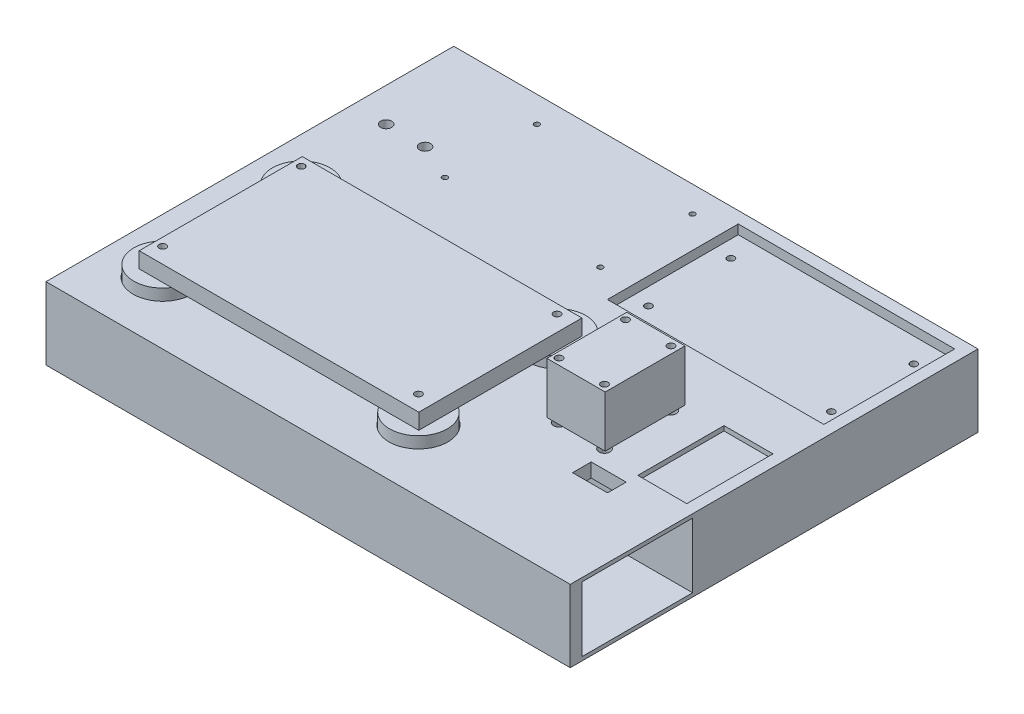
from build123d import *

# Parameters (mm, degrees)
SKETCH1_W                = 120
SKETCH1_H                = 70
SKETCH1_R                = 1.5
BOSS_EXTRUDE1_DEPTH      = 6.75
SKETCH3_R                = 12.375
BOSS_EXTRUDE2_DEPTH      = 9.75
BOSS_EXTRUDE3_DEPTH      = 26
BOSS_EXTRUDE3_DEPTH_BACK = 5
SKETCH5_W                = 225
SKETCH5_H                = 175
SKETCH8_R                = 12.625
CUT_EXTRUDE3_DEPTH       = 4
BOSS_EXTRUDE4_START      = 2
SKETCH9_W                = 25
SKETCH9_H                = 34.25
SKETCH9_R                = 1.525
BOSS_EXTRUDE4_DEPTH      = 22
SKETCH10_R               = 2.375
CUT_EXTRUDE11_DEPTH      = 10
SKETCH12_W               = 21
SKETCH12_H               = 37
CUT_EXTRUDE4_DEPTH       = 2
SKETCH11_W               = 92.9
SKETCH11_H               = 56.15
CUT_EXTRUDE8_DEPTH       = 4
SKETCH18_R               = 1.5
CUT_EXTRUDE12_DEPTH      = 10
SKETCH19_R               = 1.125
CUT_EXTRUDE13_DEPTH      = 10
SKETCH20_R               = 2.375
CUT_EXTRUDE15_DEPTH      = 10
SKETCH22_W               = 47.5
SKETCH22_H               = 27.775
CUT_EXTRUDE16_DEPTH      = 20
SKETCH23_W               = 15
SKETCH23_H               = 8
CUT_EXTRUDE17_DEPTH      = 29.3875
SKETCH24_W               = 47.5
SKETCH24_H               = 23.3875
CUT_EXTRUDE18_DEPTH      = 30


with BuildPart() as part:
    # Sketch1 → Boss-Extrude1 (new body)
    with BuildSketch(Plane(origin=(0, 0, 0), x_dir=(1, 0, 0), z_dir=(0, 1, 0))):
        Rectangle(SKETCH1_W, SKETCH1_H)
        with Locations(Location((-56.6, 31.15, 0), (0, 0, 270))):
            Circle(SKETCH1_R, mode=Mode.SUBTRACT)
        with Locations(Location((53.2, 31.15, 0), (0, 0, 90))):
            Circle(SKETCH1_R, mode=Mode.SUBTRACT)
        with Locations(Location((53.2, -28.35, 0), (0, 0, 270))):
            Circle(SKETCH1_R, mode=Mode.SUBTRACT)
        with Locations(Location((-56.6, -28.35, 0), (0, 0, 90))):
            Circle(SKETCH1_R, mode=Mode.SUBTRACT)
    extrude(amount=BOSS_EXTRUDE1_DEPTH)

    # Sketch3 → Boss-Extrude2 (add)
    with BuildSketch(Plane.XZ):
        with Locations(Location((-56.6, 28.35, 0), (0, 0, 90))):
            Circle(SKETCH3_R)
        with Locations(Location((53.2, 28.35, 0), (0, 0, 90))):
            Circle(SKETCH3_R)
        with Locations(Location((53.2, -31.15, 0), (0, 0, 90))):
            Circle(SKETCH3_R)
        with Locations(Location((-56.6, -31.15, 0), (0, 0, 90))):
            Circle(SKETCH3_R)
    extrude(amount=BOSS_EXTRUDE2_DEPTH)


with BuildPart() as body_2:
    # Sketch5 → Boss-Extrude3 (new, two sides: drawn at the far end of the back side and taken through both)
    with BuildSketch(Plane.XZ.offset(9.75).offset(-BOSS_EXTRUDE3_DEPTH_BACK)):
        with Locations((32.5, -32.5)):
            Rectangle(SKETCH5_W, SKETCH5_H)
    extrude(amount=BOSS_EXTRUDE3_DEPTH + BOSS_EXTRUDE3_DEPTH_BACK)

    # Sketch8 → Cut-Extrude3 (cut)
    with BuildSketch(Plane(origin=(0, -4.75, 0), x_dir=(1, 0, 0), z_dir=(0, 1, 0))):
        with Locations(Location((53.2, 31.15, 0), (0, 0, 270))):
            Circle(SKETCH8_R)
        with Locations(Location((-56.6, 31.15, 0), (0, 0, 270))):
            Circle(SKETCH8_R)
        with Locations(Location((-56.6, -28.35, 0), (0, 0, 270))):
            Circle(SKETCH8_R)
        with Locations(Location((53.2, -28.35, 0), (0, 0, 270))):
            Circle(SKETCH8_R)
    extrude(amount=-CUT_EXTRUDE3_DEPTH, mode=Mode.SUBTRACT)

    # Sketch10 → Cut-Extrude11 (cut)
    with BuildSketch(Plane(origin=(0, -4.75, 0), x_dir=(1, 0, 0), z_dir=(0, 1, 0))):
        with Locations(Location((101.975, 31.225, 0), (0, 0, 270))):
            Circle(SKETCH10_R)
        with Locations(Location((82.475, 31.225, 0), (0, 0, 270))):
            Circle(SKETCH10_R)
        with Locations(Location((101.975, 2.725, 0), (0, 0, 270))):
            Circle(SKETCH10_R)
        with Locations(Location((82.475, 2.725, 0), (0, 0, 270))):
            Circle(SKETCH10_R)
    extrude(amount=-CUT_EXTRUDE11_DEPTH, mode=Mode.SUBTRACT)

    # Sketch12 → Cut-Extrude4 (cut)
    with BuildSketch(Plane(origin=(0, -4.75, 0), x_dir=(1, 0, 0), z_dir=(0, 1, 0))):
        with Locations((129.5, 18.5)):
            Rectangle(SKETCH12_W, SKETCH12_H)
    extrude(amount=-CUT_EXTRUDE4_DEPTH, mode=Mode.SUBTRACT)

    # Sketch11 → Cut-Extrude8 (cut)
    with BuildSketch(Plane(origin=(0, -4.75, 0), x_dir=(1, 0, 0), z_dir=(0, 1, 0))):
        with Locations((93.55, 86.925)):
            Rectangle(SKETCH11_W, SKETCH11_H)
    extrude(amount=-CUT_EXTRUDE8_DEPTH, mode=Mode.SUBTRACT)

    # Sketch18 → Cut-Extrude12 (cut)
    with BuildSketch(Plane(origin=(0, -8.75, 0), x_dir=(1, 0, 0), z_dir=(0, 1, 0))):
        with Locations(Location((54.3, 104.625, 0), (0, 0, 270))):
            Circle(SKETCH18_R)
        with Locations(Location((54.3, 69.225, 0), (0, 0, 270))):
            Circle(SKETCH18_R)
        with Locations(Location((132.8, 69.225, 0), (0, 0, 270))):
            Circle(SKETCH18_R)
        with Locations(Location((132.8, 104.625, 0), (0, 0, 270))):
            Circle(SKETCH18_R)
    extrude(amount=-CUT_EXTRUDE12_DEPTH, mode=Mode.SUBTRACT)

    # Sketch19 → Cut-Extrude13 (cut)
    with BuildSketch(Plane(origin=(0, -4.75, 0), x_dir=(1, 0, 0), z_dir=(0, 1, 0))):
        with Locations(Location((33.6, 69.35, 0), (0, 0, 270))):
            Circle(SKETCH19_R)
        with Locations(Location((-33.15, 69.35, 0), (0, 0, 270))):
            Circle(SKETCH19_R)
        with Locations(Location((-33.15, 108.85, 0), (0, 0, 270))):
            Circle(SKETCH19_R)
        with Locations(Location((33.6, 108.85, 0), (0, 0, 270))):
            Circle(SKETCH19_R)
    extrude(amount=-CUT_EXTRUDE13_DEPTH, mode=Mode.SUBTRACT)

    # Sketch20 → Cut-Extrude15 (cut)
    with BuildSketch(Plane(origin=(0, -4.75, 0), x_dir=(1, 0, 0), z_dir=(0, 1, 0))):
        with Locations(Location((-48.8, 76.5, 0), (0, 0, 270))):
            Circle(SKETCH20_R)
        with Locations(Location((-65.5, 76.5, 0), (0, 0, 270))):
            Circle(SKETCH20_R)
    extrude(amount=-CUT_EXTRUDE15_DEPTH, mode=Mode.SUBTRACT)

    # Sketch22 → Cut-Extrude16 (cut)
    with BuildSketch(Plane.ZY.offset(-145)):
        with Locations((26.25, -20.25)):
            Rectangle(SKETCH22_W, SKETCH22_H)
    extrude(amount=CUT_EXTRUDE16_DEPTH, mode=Mode.SUBTRACT)

    # Sketch23 → Cut-Extrude17 (cut)
    with BuildSketch(Plane(origin=(0, -4.75, 0), x_dir=(1, 0, 0), z_dir=(0, 1, 0))):
        with Locations((111.5, -9)):
            Rectangle(SKETCH23_W, SKETCH23_H)
    extrude(amount=-CUT_EXTRUDE17_DEPTH, mode=Mode.SUBTRACT)

    # Sketch24 → Cut-Extrude18 (cut)
    with BuildSketch(Plane(origin=(125, 0, 0), x_dir=(0, 0, -1), z_dir=(1, 0, 0))):
        with Locations((-26.25, -22.44375)):
            Rectangle(SKETCH24_W, SKETCH24_H)
    extrude(amount=-CUT_EXTRUDE18_DEPTH, mode=Mode.SUBTRACT)


with BuildPart() as body_3:
    # Sketch9 → Boss-Extrude4 (new body)
    with BuildSketch(Plane(origin=(0, -4.75, 0), x_dir=(1, 0, 0), z_dir=(0, 1, 0)).offset(BOSS_EXTRUDE4_START)):
        with Locations((92.5, 17.125)):
            Rectangle(SKETCH9_W, SKETCH9_H)
        with Locations(Location((101.975, 2.725, 0), (0, 0, 270))):
            Circle(SKETCH9_R, mode=Mode.SUBTRACT)
        with Locations(Location((82.475, 2.725, 0), (0, 0, 270))):
            Circle(SKETCH9_R, mode=Mode.SUBTRACT)
        with Locations(Location((82.475, 31.225, 0), (0, 0, 270))):
            Circle(SKETCH9_R, mode=Mode.SUBTRACT)
        with Locations(Location((101.975, 31.225, 0), (0, 0, 270))):
            Circle(SKETCH9_R, mode=Mode.SUBTRACT)
    extrude(amount=BOSS_EXTRUDE4_DEPTH)


solid = Compound([part.part, body_2.part, body_3.part])
